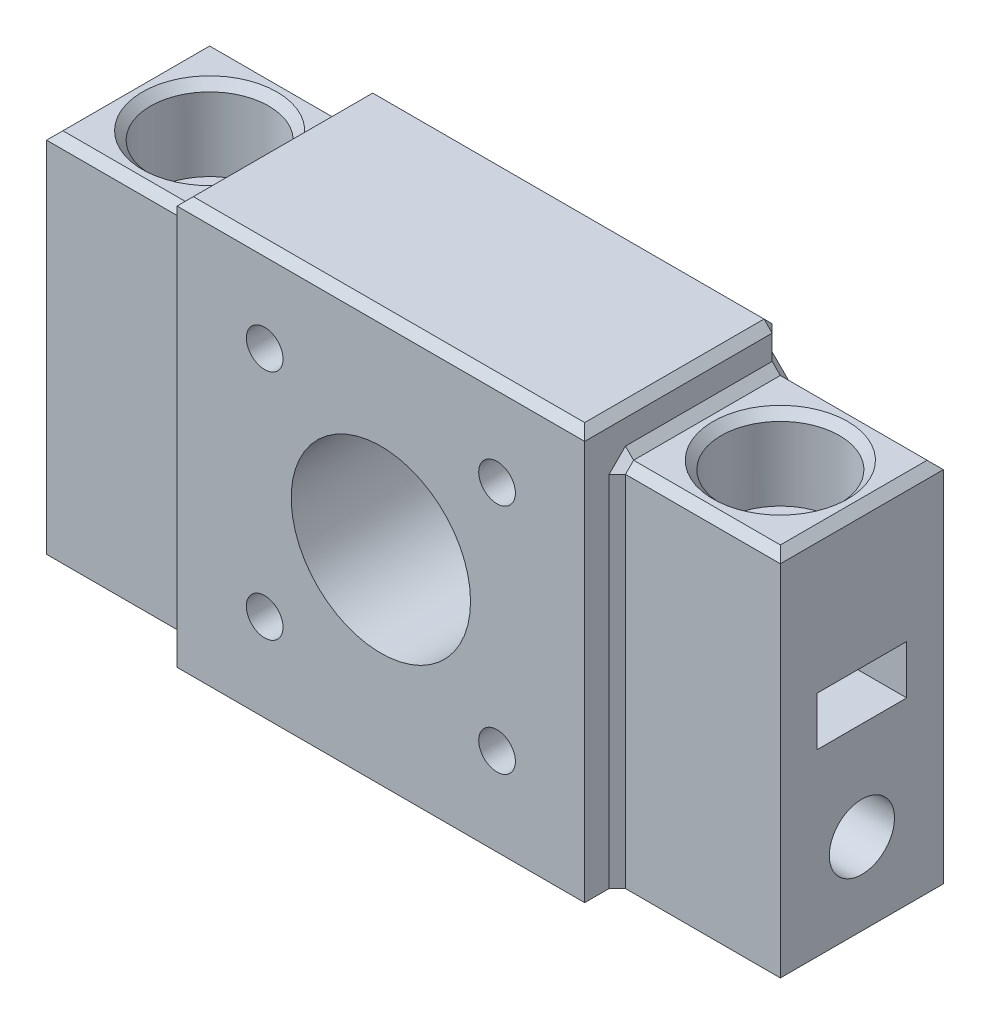
from build123d import *

# Parameters (mm, degrees)
SKETCH1_R              = 11
BODY_DEPTH             = 10
M4_CLEARANCE_HOLE1_D   = 4.5
ELEVATION_START        = 4
SKETCH10_W             = 50
SKETCH10_H             = 50
SKETCH10_R             = 2.25
SKETCH10_R_2           = 11
ELEVATION_DEPTH        = 4
SKETCH13_R             = 3.75
M4_SCREW_PLACE_DEPTH   = 4
SKETCH14_R             = 7.25
SPRING_HOLE_DEPTH      = 10
SKETCH15_W             = 11
SKETCH15_H             = 6
NUT_HOLE_DEPTH         = 20
SKETCH16_R             = 3.25
SHAFT_HOLE_DEPTH       = 13
SKETCH17_R             = 4
BRAKE_SCREW_HOLE_DEPTH = 20
SKETCH18_W             = 6
SKETCH18_H             = 11
BRAKE_NUT_HOLE_DEPTH   = 25
CHAMFER1_SIZE          = 1


with BuildPart() as part:
    # Sketch1 → Body (new, symmetric)
    with BuildSketch(Plane.XY):
        Polygon((25, -25), (-25, -25), (-45, -25), (-45, 20), (-25, 20), (-25, 25), (25, 25), (25, 20), (45, 20), (45, -25), align=None)
        Circle(SKETCH1_R, mode=Mode.SUBTRACT)
    extrude(amount=BODY_DEPTH, both=True)

    # M4 Clearance Hole1 (through all)
    with Locations(Plane(origin=(0, 0, -10), x_dir=(-1, 0, 0), z_dir=(0, 0, -1))):
        with Locations((0, 0), (-14.25, 14.25), (14.25, -14.25), (14.25, 14.25), (-14.25, -14.25)):
            Hole(M4_CLEARANCE_HOLE1_D / 2)

    # Sketch10 → Elevation (add)
    with BuildSketch(Plane.XY.offset(10).offset(ELEVATION_START)):
        Rectangle(SKETCH10_W, SKETCH10_H)
        with Locations(Location((-14.25, -14.25, 0), (0, 0, 180))):
            Circle(SKETCH10_R, mode=Mode.SUBTRACT)
        with Locations(Location((14.25, -14.25, 0), (0, 0, 180))):
            Circle(SKETCH10_R, mode=Mode.SUBTRACT)
        with Locations(Location((14.25, 14.25, 0), (0, 0, 180))):
            Circle(SKETCH10_R, mode=Mode.SUBTRACT)
        Circle(SKETCH10_R_2, mode=Mode.SUBTRACT)
        with Locations(Location((-14.25, 14.25, 0), (0, 0, 180))):
            Circle(SKETCH10_R, mode=Mode.SUBTRACT)
    extrude(amount=-ELEVATION_DEPTH)

    # Sketch13 → M4_Screw_Place (cut)
    with BuildSketch(Plane(origin=(0, 0, -10), x_dir=(-1, 0, 0), z_dir=(0, 0, -1))):
        with Locations((-14.25, 14.25)):
            Circle(SKETCH13_R)
        with Locations((14.25, 14.25)):
            Circle(SKETCH13_R)
        with Locations((14.25, -14.25)):
            Circle(SKETCH13_R)
        with Locations((-14.25, -14.25)):
            Circle(SKETCH13_R)
    extrude(amount=-M4_SCREW_PLACE_DEPTH, mode=Mode.SUBTRACT)

    # Sketch14 → Spring_Hole (cut)
    with BuildSketch(Plane(origin=(0, 20, 0), x_dir=(1, 0, 0), z_dir=(0, 1, 0))):
        with Locations(Location((-35, 0, 0), (0, 0, 180))):
            Circle(SKETCH14_R)
    spring_hole = extrude(amount=-SPRING_HOLE_DEPTH, mode=Mode.SUBTRACT)

    # Sketch15 → Nut_Hole (cut)
    with BuildSketch(Plane.ZY.offset(45)):
        Rectangle(SKETCH15_W, SKETCH15_H)
    nut_hole = extrude(amount=-NUT_HOLE_DEPTH, mode=Mode.SUBTRACT)

    # Sketch16 → Shaft_Hole (cut)
    with BuildSketch(Plane(origin=(0, 10, 0), x_dir=(1, 0, 0), z_dir=(0, 1, 0))):
        with Locations(Location((-35, 0, 0), (0, 0, 180))):
            Circle(SKETCH16_R)
    shaft_hole = extrude(amount=-SHAFT_HOLE_DEPTH, mode=Mode.SUBTRACT)

    # Sketch17 → Brake_Screw_Hole (cut)
    with BuildSketch(Plane.ZY.offset(45)):
        with Locations((0, -15)):
            Circle(SKETCH17_R)
    brake_screw_hole = extrude(amount=-BRAKE_SCREW_HOLE_DEPTH, mode=Mode.SUBTRACT)

    # Sketch18 → Brake_Nut_Hole (cut)
    with BuildSketch(Plane.XZ.offset(25)):
        with Locations((28, 0)):
            Rectangle(SKETCH18_W, SKETCH18_H)
    brake_nut_hole = extrude(amount=-BRAKE_NUT_HOLE_DEPTH, mode=Mode.SUBTRACT)

    # Mirror1: Spring_Hole, Nut_Hole, Shaft_Hole, Brake_Screw_Hole, Brake_Nut_Hole across plane
    add(spring_hole.mirror(Plane(origin=(0, 0, 0), x_dir=(0, 0, 1), z_dir=(1, 0, 0))), mode=Mode.SUBTRACT)
    add(nut_hole.mirror(Plane(origin=(0, 0, 0), x_dir=(0, 0, 1), z_dir=(1, 0, 0))), mode=Mode.SUBTRACT)
    add(shaft_hole.mirror(Plane(origin=(0, 0, 0), x_dir=(0, 0, 1), z_dir=(1, 0, 0))), mode=Mode.SUBTRACT)
    add(brake_screw_hole.mirror(Plane(origin=(0, 0, 0), x_dir=(0, 0, 1), z_dir=(1, 0, 0))), mode=Mode.SUBTRACT)
    add(brake_nut_hole.mirror(Plane(origin=(0, 0, 0), x_dir=(0, 0, 1), z_dir=(1, 0, 0))), mode=Mode.SUBTRACT)

    # Chamfer1
    chamfer1_edges = [part.edges().sort_by_distance(p)[0] for p in [
        (25, 22.5, -10),
        (35, 20, -10),
        (-27.75, 20, 0),
        (-35, 20, 10),
        (-35, 20, -10),
        (-25, 22.5, -10),
        (0, 25, -10),
        (27.75, 20, 0),
        (25, 25, 2),
        (25, 20, 0),
        (45, 20, 0),
        (-45, 20, 0),
        (-25, 20, 0),
        (-25, 25, 2),
        (35, 20, 10),
        (-25, -2.5, 10),
        (0, 25, 14),
        (25, -2.5, 10),
    ]]
    chamfer(chamfer1_edges, length=CHAMFER1_SIZE)


solid = part.part
